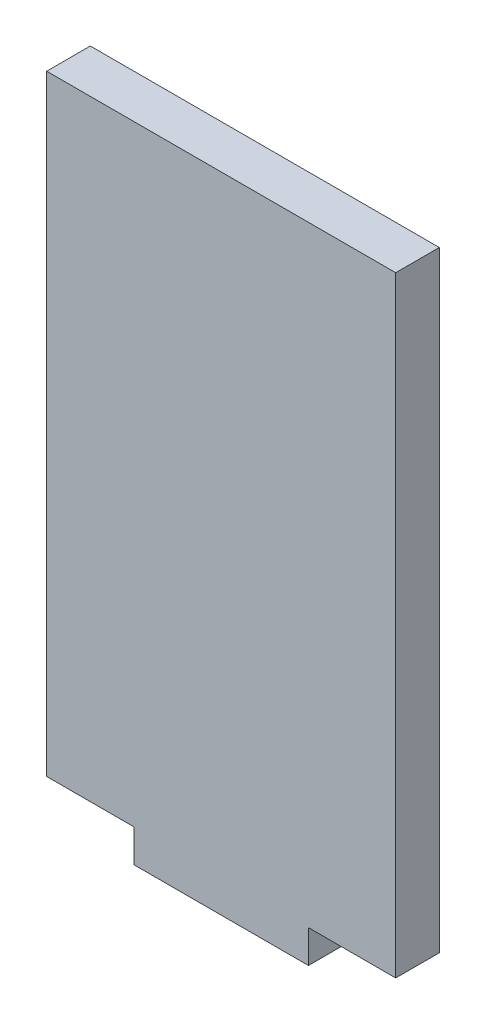
from build123d import *

# Parameters (mm, degrees)
BOSS_EXTRUDE1_DEPTH = 3.175


with BuildPart() as part:
    # Sketch1 → Boss-Extrude1 (new body)
    with BuildSketch(Plane.XY):
        Polygon((6.35, 0), (6.35, -2.387934918), (19.05, -2.387934918), (19.05, 0), (25.4, 0), (25.4, 44.45), (0, 44.45), (0, 0), align=None)
    extrude(amount=BOSS_EXTRUDE1_DEPTH)


solid = part.part
